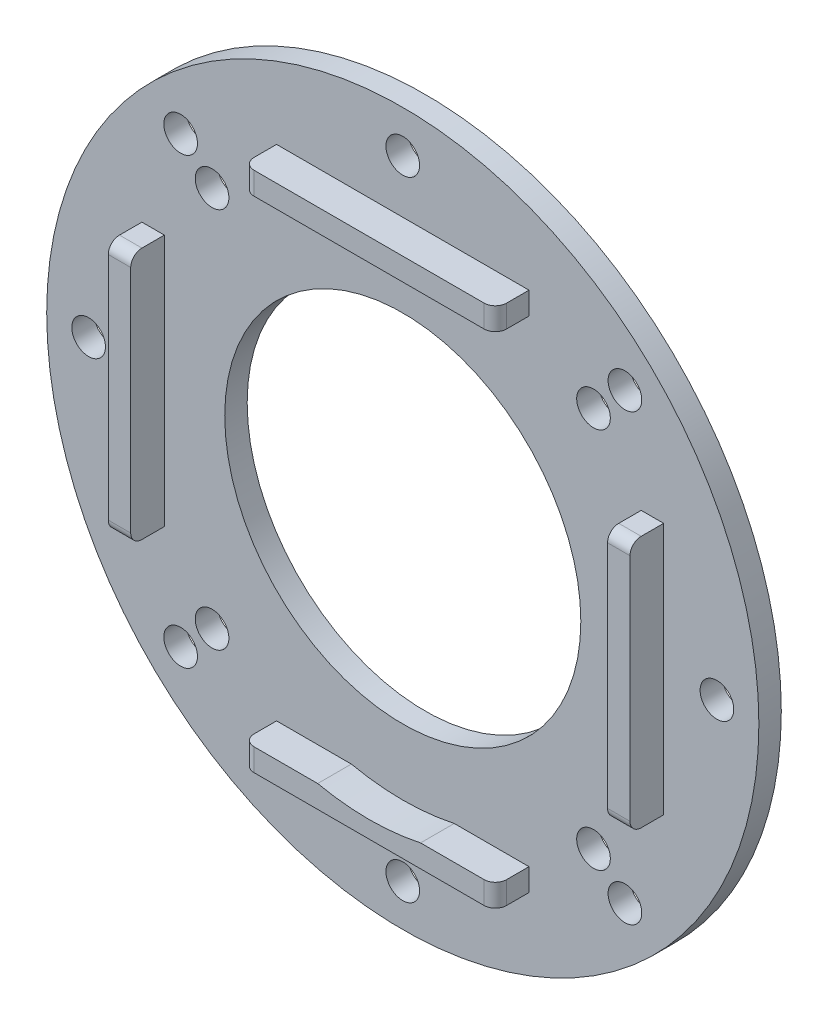
from build123d import *

# Parameters (mm, degrees)
SKETCH_1_R      = 31.73899895
SKETCH_1_R_2    = 15.869499475
SKETCH_1_R_3    = 1.5
EXTRUDE_2_DEPTH = 2
EXTRUDE_3_DEPTH = 3
FILLET_1_R      = 1
FILLET_2_R      = 1
FILLET_3_R      = 1
FILLET_4_R      = 1
FILLET_5_R      = 1
FILLET_6_R      = 1
FILLET_7_R      = 1
FILLET_8_R      = 1


with BuildPart() as part:
    # 草图1 → 凸台-拉伸2 (new body)
    with BuildSketch(Plane.XY):
        Circle(SKETCH_1_R)
        Circle(SKETCH_1_R_2, mode=Mode.SUBTRACT)
        with Locations((-17, 17)):
            Circle(SKETCH_1_R_3, mode=Mode.SUBTRACT)
        with Locations((17, 17)):
            Circle(SKETCH_1_R_3, mode=Mode.SUBTRACT)
        with Locations((17, -17)):
            Circle(SKETCH_1_R_3, mode=Mode.SUBTRACT)
        with Locations((-17, -17)):
            Circle(SKETCH_1_R_3, mode=Mode.SUBTRACT)
        with Locations((-19.798989873, 19.798989873)):
            Circle(SKETCH_1_R_3, mode=Mode.SUBTRACT)
        with Locations((0, 28)):
            Circle(SKETCH_1_R_3, mode=Mode.SUBTRACT)
        with Locations((19.798989873, 19.798989873)):
            Circle(SKETCH_1_R_3, mode=Mode.SUBTRACT)
        with Locations((28, 0)):
            Circle(SKETCH_1_R_3, mode=Mode.SUBTRACT)
        with Locations((19.798989873, -19.798989873)):
            Circle(SKETCH_1_R_3, mode=Mode.SUBTRACT)
        with Locations((0, -28)):
            Circle(SKETCH_1_R_3, mode=Mode.SUBTRACT)
        with Locations((-19.798989873, -19.798989873)):
            Circle(SKETCH_1_R_3, mode=Mode.SUBTRACT)
        with Locations((-28, 0)):
            Circle(SKETCH_1_R_3, mode=Mode.SUBTRACT)
    extrude(amount=EXTRUDE_2_DEPTH)

    # 草图2 → 凸台-拉伸3 (add)
    with BuildSketch(Plane.XY.offset(2)):
        with BuildLine():
            Line((11.25, 23.25), (-11.25, 23.25))
            Line((-11.25, 23.25), (-11.25, 21.25))
            Line((-11.25, 21.25), (-4.584929155, 21.25))
            ThreePointArc((-4.584929155, 21.25), (0, 21.73899895), (4.584929155, 21.25))
            Line((4.584929155, 21.25), (11.25, 21.25))
            Line((11.25, 21.25), (11.25, 23.25))
        make_face()
        with BuildLine():
            Line((-23.25, 11.25), (-23.25, -11.25))
            Line((-23.25, -11.25), (-21.25, -11.25))
            Line((-21.25, -11.25), (-21.25, -4.584929155))
            ThreePointArc((-21.25, -4.584929155), (-21.73899895, 0), (-21.25, 4.584929155))
            Line((-21.25, 4.584929155), (-21.25, 11.25))
            Line((-21.25, 11.25), (-23.25, 11.25))
        make_face()
        with BuildLine():
            Line((21.25, -11.25), (23.25, -11.25))
            Line((23.25, -11.25), (23.25, 11.25))
            Line((23.25, 11.25), (21.25, 11.25))
            Line((21.25, 11.25), (21.25, 4.584929155))
            ThreePointArc((21.25, 4.584929155), (21.616403529, 2.305466077), (21.73899895, 0))
            ThreePointArc((21.73899895, 0), (21.616403529, -2.305466077), (21.25, -4.584929155))
            Line((21.25, -4.584929155), (21.25, -11.25))
        make_face()
        with BuildLine():
            Line((-11.25, -21.25), (-11.25, -23.25))
            Line((-11.25, -23.25), (11.25, -23.25))
            Line((11.25, -23.25), (11.25, -21.25))
            Line((11.25, -21.25), (4.584929155, -21.25))
            ThreePointArc((4.584929155, -21.25), (0, -21.73899895), (-4.584929155, -21.25))
            Line((-4.584929155, -21.25), (-11.25, -21.25))
        make_face()
        with BuildLine():
            ThreePointArc((-21.25, 4.584929155), (-21.73899895, 0), (-21.25, -4.584929155))
            Line((-21.25, -4.584929155), (-21.25, 4.584929155))
        make_face()
        with BuildLine():
            ThreePointArc((4.584929155, 21.25), (0, 21.73899895), (-4.584929155, 21.25))
            Line((-4.584929155, 21.25), (4.584929155, 21.25))
        make_face()
        with BuildLine():
            Line((21.25, 4.584929155), (21.25, -4.584929155))
            ThreePointArc((21.25, -4.584929155), (21.616403529, -2.305466077), (21.73899895, 0))
            ThreePointArc((21.73899895, 0), (21.616403529, 2.305466077), (21.25, 4.584929155))
        make_face()
    extrude(amount=EXTRUDE_3_DEPTH)

    # 圆角1
    fillet_1_edges = [part.edges().sort_by_distance(p)[0] for p in [
        (-22.25, -11.25, 5),
    ]]
    fillet(fillet_1_edges, radius=FILLET_1_R)

    # 圆角2
    fillet_2_edges = [part.edges().sort_by_distance(p)[0] for p in [
        (-22.25, 11.25, 5),
    ]]
    fillet(fillet_2_edges, radius=FILLET_2_R)

    # 圆角3
    fillet_3_edges = [part.edges().sort_by_distance(p)[0] for p in [
        (-11.25, 22.25, 5),
    ]]
    fillet(fillet_3_edges, radius=FILLET_3_R)

    # 圆角4
    fillet_4_edges = [part.edges().sort_by_distance(p)[0] for p in [
        (11.25, 22.25, 5),
    ]]
    fillet(fillet_4_edges, radius=FILLET_4_R)

    # 圆角5
    fillet_5_edges = [part.edges().sort_by_distance(p)[0] for p in [
        (22.25, 11.25, 5),
    ]]
    fillet(fillet_5_edges, radius=FILLET_5_R)

    # 圆角6
    fillet_6_edges = [part.edges().sort_by_distance(p)[0] for p in [
        (22.25, -11.25, 5),
    ]]
    fillet(fillet_6_edges, radius=FILLET_6_R)

    # 圆角7
    fillet_7_edges = [part.edges().sort_by_distance(p)[0] for p in [
        (11.25, -22.25, 5),
    ]]
    fillet(fillet_7_edges, radius=FILLET_7_R)

    # 圆角8
    fillet_8_edges = [part.edges().sort_by_distance(p)[0] for p in [
        (-11.25, -22.25, 5),
    ]]
    fillet(fillet_8_edges, radius=FILLET_8_R)


solid = part.part
